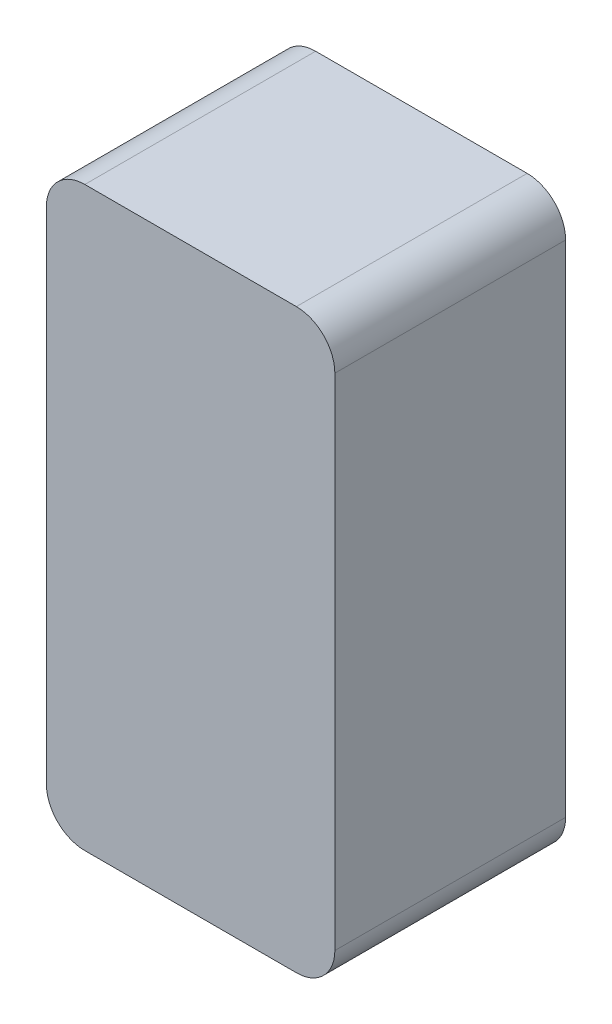
from build123d import *

# Parameters (mm, degrees)
SKETCH1_W                       = 15
SKETCH1_H                       = 30
SKETCH1_W_2                     = 12
SKETCH1_H_2                     = 27
BOSS_EXTRUDE1_DEPTH             = 10
BOSS_EXTRUDE2_REACH             = 33.121
SKETCH2_W                       = 15
SKETCH2_H                       = 2
BOSS_EXTRUDE2_DIRECTION_2_REACH = 33.121
SKETCH3_R                       = 4.953
CUT_EXTRUDE2_DEPTH              = 10
FILLET1_R                       = 2


with BuildPart() as part:
    # Sketch1 → Boss-Extrude1 (new body)
    with BuildSketch(Plane.XY):
        Rectangle(SKETCH1_W, SKETCH1_H)
        Rectangle(SKETCH1_W_2, SKETCH1_H_2, mode=Mode.SUBTRACT)
    extrude(amount=BOSS_EXTRUDE1_DEPTH)

    # Boss-Extrude2: up to this face of the body (flat: up to its plane)
    boss_extrude2_end = Plane(part.part.faces().sort_by_distance((0, 15, 5))[0])
    # Sketch2 → Boss-Extrude2 (add, up to the picked face)
    with BuildSketch(Plane(origin=(0, -13.5, 0), x_dir=(1, 0, 0), z_dir=(0, 1, 0)), mode=Mode.PRIVATE) as boss_extrude2_sk1:
        with Locations((0, -11)):
            Rectangle(SKETCH2_W, SKETCH2_H)
    boss_extrude2_tool1 = split(extrude(boss_extrude2_sk1.sketch, amount=BOSS_EXTRUDE2_REACH, mode=Mode.PRIVATE), bisect_by=boss_extrude2_end, keep=Keep.BOTH, mode=Mode.PRIVATE)
    add(boss_extrude2_tool1.solids().sort_by(Axis((0, -13.5, 11), (0, 1, 0)))[0])

    # Boss-Extrude2 direction 2: up to this face of the body (flat: up to its plane)
    boss_extrude2_direction_2_end = Plane(part.part.faces().sort_by_distance((0, -15, 5))[0])
    # Sketch2 → Boss-Extrude2 direction 2 (add, up to the picked face)
    with BuildSketch(Plane(origin=(0, -13.5, 0), x_dir=(1, 0, 0), z_dir=(0, 1, 0)), mode=Mode.PRIVATE) as boss_extrude2_direction_2_sk1:
        with Locations((0, -11)):
            Rectangle(SKETCH2_W, SKETCH2_H)
    boss_extrude2_direction_2_tool1 = split(extrude(boss_extrude2_direction_2_sk1.sketch, amount=-BOSS_EXTRUDE2_DIRECTION_2_REACH, mode=Mode.PRIVATE), bisect_by=boss_extrude2_direction_2_end, keep=Keep.BOTH, mode=Mode.PRIVATE)
    add(boss_extrude2_direction_2_tool1.solids().sort_by(Axis((0, -13.5, 11), (0, -1, 0)))[0])

    # Sketch3 → Cut-Extrude2 (cut)
    with BuildSketch(Plane.XZ.offset(15)):
        with Locations(Location((0, 5, 0), (0, 0, 270))):
            Circle(SKETCH3_R)
    extrude(amount=-CUT_EXTRUDE2_DEPTH, mode=Mode.SUBTRACT)

    # Fillet1
    fillet1_edges = [part.edges().sort_by_distance(p)[0] for p in [
        (-7.5, 15, 6),
        (7.5, 15, 6),
        (7.5, -15, 6),
        (-7.5, -15, 6),
    ]]
    fillet(fillet1_edges, radius=FILLET1_R)


solid = part.part
